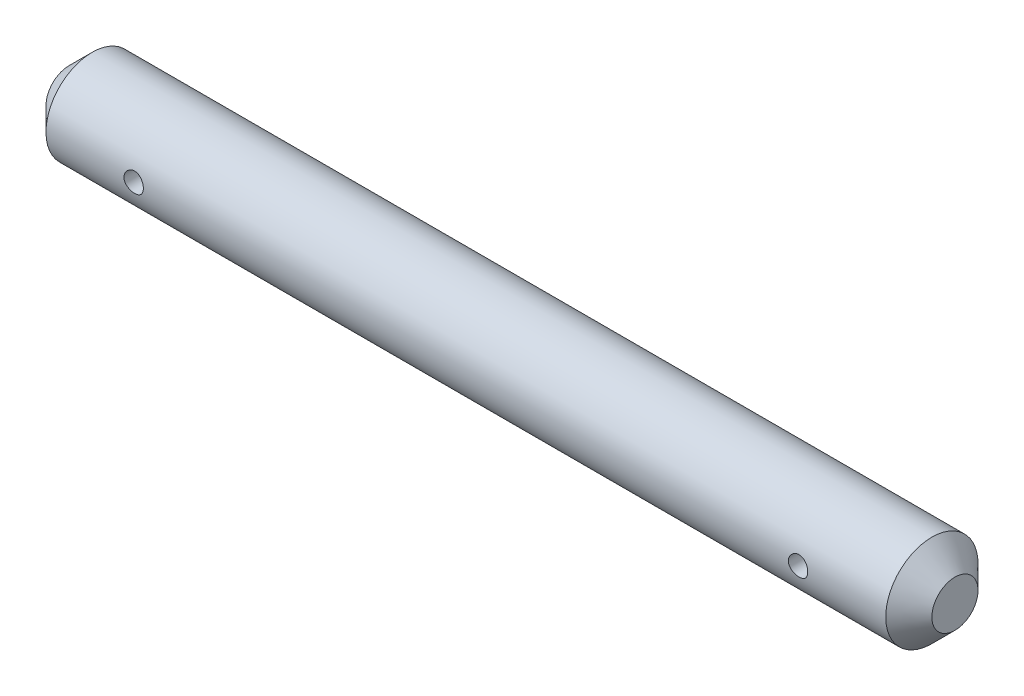
from build123d import *

# Parameters (mm, degrees)
SKETCH1_W               = 96
SKETCH1_H               = 5
CUT_EXTRUDE1_DEPTH      = 41
CUT_EXTRUDE1_DEPTH_BACK = 20
SKETCH1_5_R             = 1.05
CUT_EXTRUDE2_DEPTH      = 20
CUT_EXTRUDE2_DEPTH_BACK = 20
SKETCH1_6_R             = 1.05
CHAMFER1_SIZE           = 2.5
CHAMFER2_SIZE           = 2.5


with BuildPart() as part:
    # Sketch1 → Revolve1 (revolve)
    with BuildSketch(Plane.XY):
        with Locations((0, 2.5)):
            Rectangle(SKETCH1_W, SKETCH1_H)
    revolve(axis=Axis((-48, 0, 0), (1, 0, 0)))

    # Sketch1<5> → Cut-Extrude1 (cut, two sides: drawn at the far end of the back side and taken through both)
    with BuildSketch(Plane.XY.offset(-CUT_EXTRUDE1_DEPTH_BACK)):
        with Locations((-36, 0)):
            Circle(SKETCH1_5_R)
    extrude(amount=CUT_EXTRUDE1_DEPTH + CUT_EXTRUDE1_DEPTH_BACK, mode=Mode.SUBTRACT)

    # Sketch1<6> → Cut-Extrude2 (cut, two sides: drawn at the far end of the back side and taken through both)
    with BuildSketch(Plane.XY.offset(-CUT_EXTRUDE2_DEPTH_BACK)):
        with Locations((36, 0)):
            Circle(SKETCH1_6_R)
    extrude(amount=CUT_EXTRUDE2_DEPTH + CUT_EXTRUDE2_DEPTH_BACK, mode=Mode.SUBTRACT)

    # Chamfer1
    chamfer1_edges = [part.edges().sort_by_distance(p)[0] for p in [
        (-48, -5, 0),
    ]]
    chamfer(chamfer1_edges, length=CHAMFER1_SIZE)

    # Chamfer2
    chamfer2_edges = [part.edges().sort_by_distance(p)[0] for p in [
        (48, -5, 0),
    ]]
    chamfer(chamfer2_edges, length=CHAMFER2_SIZE)


solid = part.part
